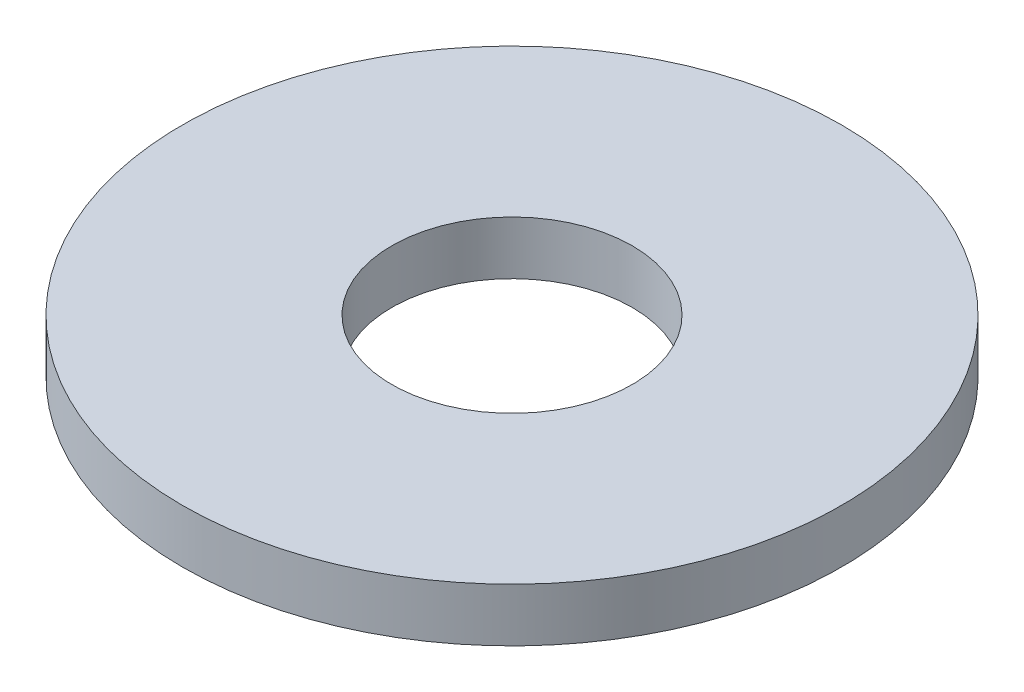
from build123d import *

# Parameters (mm, degrees)
SKETCH_1_W = 11.75
SKETCH_1_H = 3


with BuildPart() as part:
    # 草图1 → Revolve 437 (revolve)
    with BuildSketch(Plane.XY, mode=Mode.PRIVATE) as revolve_437_sk:
        with Locations((-12.625, 10.144507042)):
            Rectangle(SKETCH_1_W, SKETCH_1_H)
    revolve(revolve_437_sk.sketch.rotate(Axis((0, 0, 0), (0, 1, 0)), 270), axis=Axis((0, 0, 0), (0, 1, 0)))


solid = part.part
